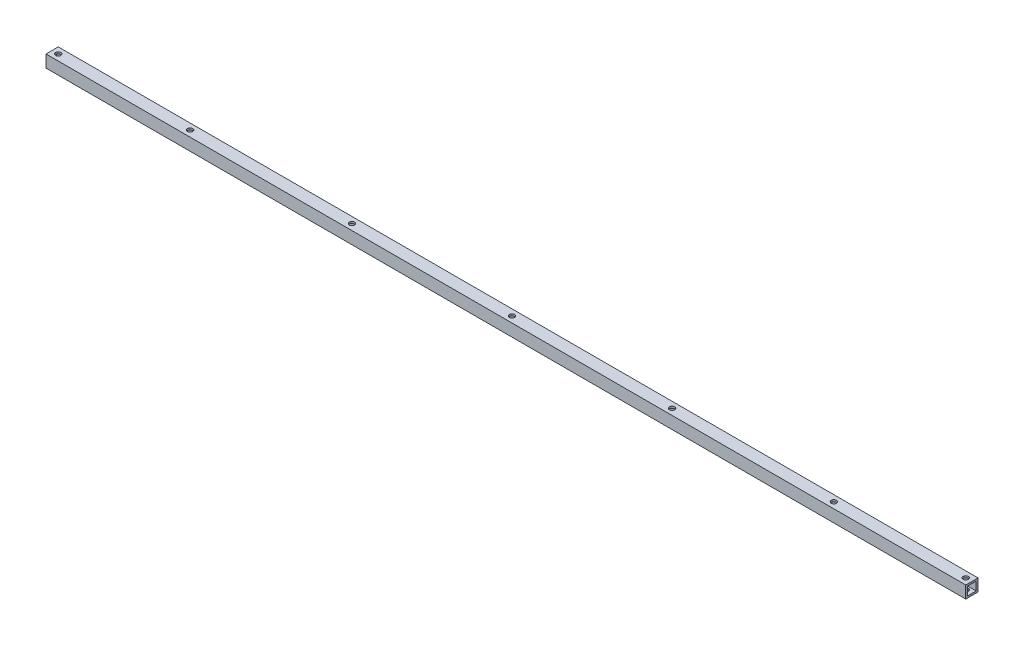
from build123d import *

# Parameters (mm, degrees)
SKETCH_1_W          = 10
SKETCH_1_H          = 10
SKETCH_1_W_2        = 7
SKETCH_1_H_2        = 7
EXTRUDE_1_DEPTH     = 750
SKETCH_2_R          = 2.15
CUT_EXTRUDE_1_DEPTH = 751.083328704


with BuildPart() as part:
    # ｽｹｯﾁ1 → 押し出し-薄板1 (new body)
    with BuildSketch(Plane(origin=(0, 0, 0), x_dir=(0, 0, -1), z_dir=(1, 0, 0))):
        Rectangle(SKETCH_1_W, SKETCH_1_H)
        Rectangle(SKETCH_1_W_2, SKETCH_1_H_2, mode=Mode.SUBTRACT)
    extrude(amount=EXTRUDE_1_DEPTH)

    # ｽｹｯﾁ2 → ｶｯﾄ - 押し出し1 (cut, through all)
    with BuildSketch(Plane(origin=(0, 5, 0), x_dir=(1, 0, 0), z_dir=(0, 1, 0))):
        with Locations(Location((745, 0, 0), (0, 0, 270))):
            Circle(SKETCH_2_R)
        with Locations(Location((5, 0, 0), (0, 0, 270))):
            Circle(SKETCH_2_R)
        with Locations(Location((505.5, 0, 0), (0, 0, 270))):
            Circle(SKETCH_2_R)
        with Locations(Location((244.5, 0, 0), (0, 0, 270))):
            Circle(SKETCH_2_R)
        with Locations(Location((637.5, 0, 0), (0, 0, 270))):
            Circle(SKETCH_2_R)
        with Locations(Location((112.5, 0, 0), (0, 0, 270))):
            Circle(SKETCH_2_R)
        with Locations(Location((375, 0, 0), (0, 0, 270))):
            Circle(SKETCH_2_R)
    extrude(amount=-CUT_EXTRUDE_1_DEPTH, mode=Mode.SUBTRACT)


solid = part.part
